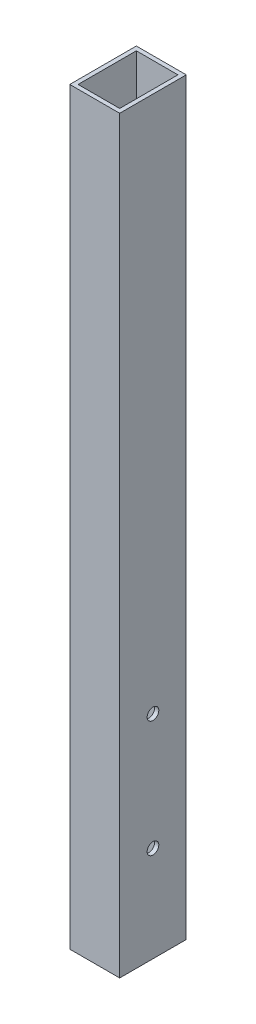
from build123d import *

# Parameters (mm, degrees)
SKETCH1_W           = 76.2
SKETCH1_H           = 101.6
BOSS_EXTRUDE1_DEPTH = 1143
SKETCH2_W           = 63.5
SKETCH2_H           = 88.9
CUT_EXTRUDE1_DEPTH  = 1145.76252996
SKETCH3_R           = 8.89
CUT_EXTRUDE2_DEPTH  = 1147.663019374


with BuildPart() as part:
    # Sketch1 → Boss-Extrude1 (new body)
    with BuildSketch(Plane(origin=(0, 0, 0), x_dir=(1, 0, 0), z_dir=(0, 1, 0))):
        Rectangle(SKETCH1_W, SKETCH1_H)
    extrude(amount=-BOSS_EXTRUDE1_DEPTH)

    # Sketch2 → Cut-Extrude1 (cut, through all)
    with BuildSketch(Plane.XZ.offset(1143)):
        Rectangle(SKETCH2_W, SKETCH2_H)
    extrude(amount=-CUT_EXTRUDE1_DEPTH, mode=Mode.SUBTRACT)

    # Sketch3 → Cut-Extrude2 (cut, through all)
    with BuildSketch(Plane(origin=(38.1, 0, 0), x_dir=(0, 0, -1), z_dir=(1, 0, 0))):
        with Locations((0, -996.95)):
            Circle(SKETCH3_R)
        with Locations((0, -819.15)):
            Circle(SKETCH3_R)
    extrude(amount=-CUT_EXTRUDE2_DEPTH, mode=Mode.SUBTRACT)


solid = part.part
